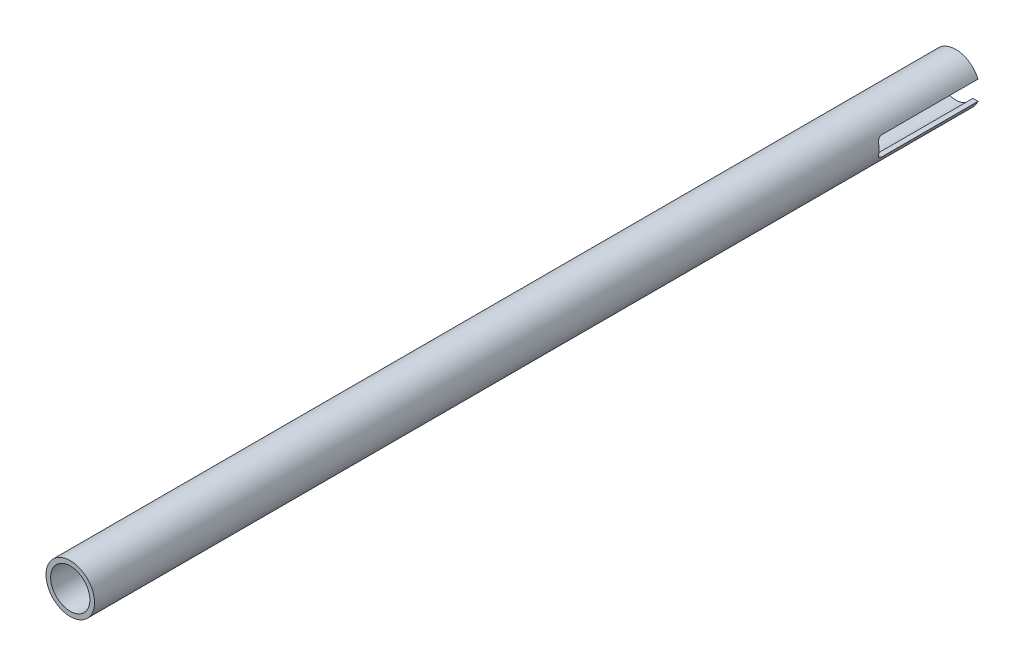
from build123d import *

# Parameters (mm, degrees)
SKETCH1_R               = 8.001
SKETCH1_R_2             = 6.477
BOSS_EXTRUDE1_DEPTH     = 292.1
CUT_EXTRUDE1_DEPTH      = 293.319075672
CUT_EXTRUDE1_DEPTH_BACK = 293.319075672


with BuildPart() as part:
    # Sketch1 → Boss-Extrude1 (new body)
    with BuildSketch(Plane.XY):
        Circle(SKETCH1_R)
        Circle(SKETCH1_R_2, mode=Mode.SUBTRACT)
    extrude(amount=BOSS_EXTRUDE1_DEPTH)

    # Sketch2 → Cut-Extrude1 (cut, two sides: drawn at the far end of the back side and taken through both)
    with BuildSketch(Plane(origin=(0, 0, 0), x_dir=(0, 0, -1), z_dir=(1, 0, 0)).offset(-CUT_EXTRUDE1_DEPTH_BACK)):
        with BuildLine():
            Line((594.627447101, 3.175), (0, 3.175))
            Line((0, 3.175), (-31.75, 3.175))
            ThreePointArc((-31.75, 3.175), (-32.827630735, 2.728630735), (-33.274, 1.651))
            Line((-33.274, 1.651), (-33.274, -1.651))
            ThreePointArc((-33.274, -1.651), (-32.827630735, -2.728630735), (-31.75, -3.175))
            Line((-31.75, -3.175), (0, -3.175))
            Line((0, -3.175), (594.627447101, -3.175))
            Line((594.627447101, -3.175), (1783.882341303, -3.175))
            Line((1783.882341303, -3.175), (1783.882341303, 3.175))
            Line((1783.882341303, 3.175), (594.627447101, 3.175))
        make_face()
    extrude(amount=CUT_EXTRUDE1_DEPTH + CUT_EXTRUDE1_DEPTH_BACK, mode=Mode.SUBTRACT)


solid = part.part
